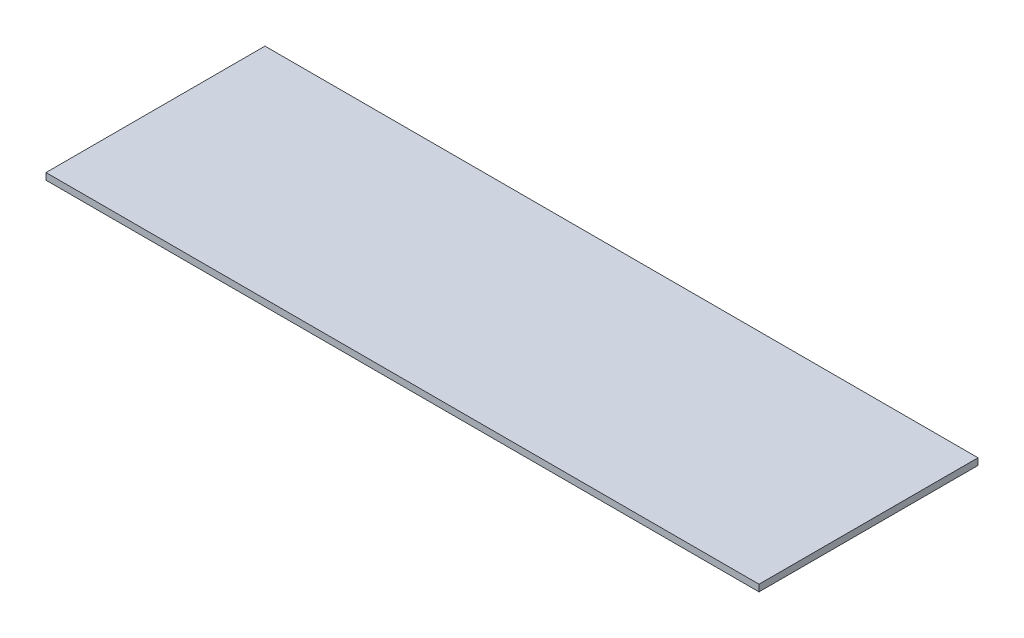
from build123d import *

# Parameters (mm, degrees)
SKETCH_1_W      = 320
SKETCH_1_H      = 98.28
EXTRUDE_1_DEPTH = 3


with BuildPart() as part:
    # 草图1 → 凸台-拉伸1 (new body)
    with BuildSketch(Plane(origin=(0, 0, 0), x_dir=(1, 0, 0), z_dir=(0, 1, 0))):
        Rectangle(SKETCH_1_W, SKETCH_1_H)
    extrude(amount=EXTRUDE_1_DEPTH)


solid = part.part
